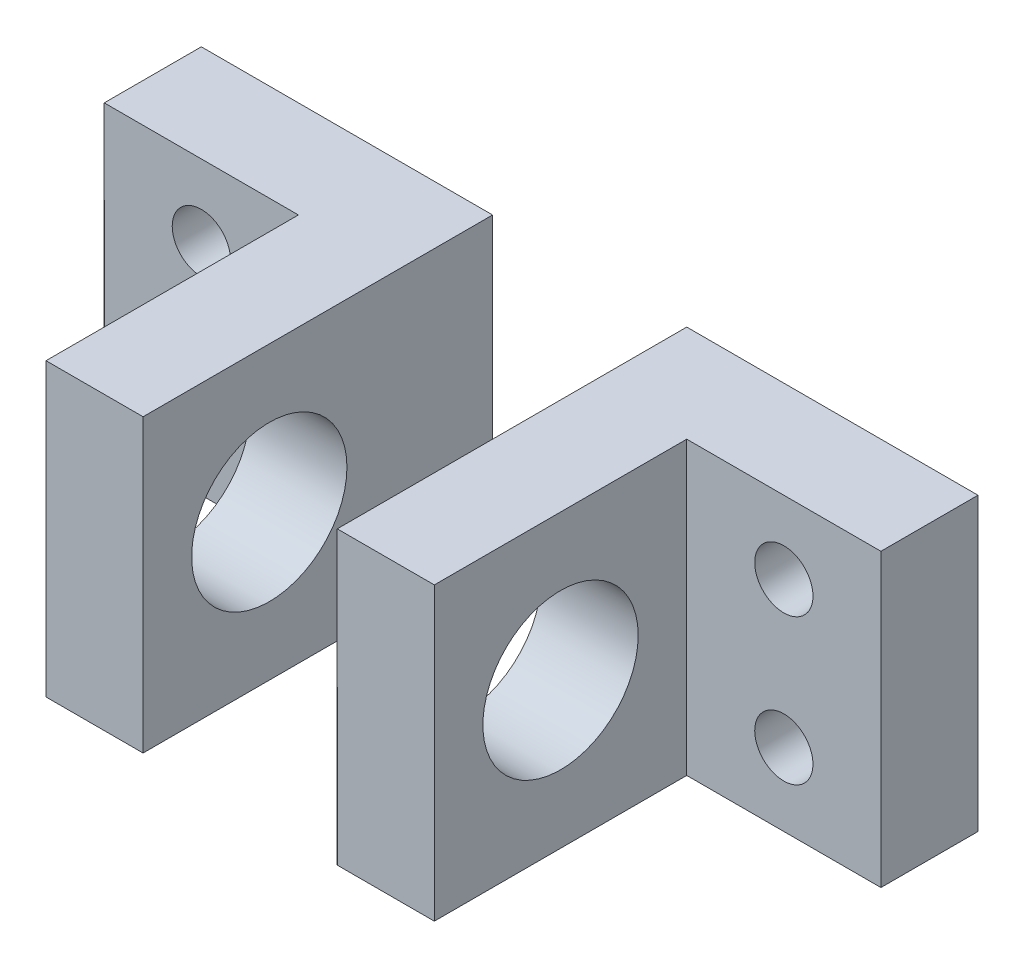
from build123d import *

# Parameters (mm, degrees)
BOSS_EXTRUDE1_DEPTH   = 15
BOSS_EXTRUDE1_2_DEPTH = 15
SKETCH2_R             = 4
CUT_EXTRUDE1_DEPTH    = 39.065732621
SKETCH3_R             = 1.5
CUT_EXTRUDE2_DEPTH    = 29.178005607


with BuildPart() as part:
    # Sketch1 → Boss-Extrude1 (new body)
    with BuildSketch(Plane(origin=(0, 0, 0), x_dir=(1, 0, 0), z_dir=(0, 1, 0))):
        Polygon((-5, 18), (-5, 0), (-10, 0), (-10, 13), (-20, 13), (-20, 18), align=None)
    extrude(amount=BOSS_EXTRUDE1_DEPTH)


with BuildPart() as body_2:
    # Sketch1 → Boss-Extrude1 2 (new body)
    with BuildSketch(Plane(origin=(0, 0, 0), x_dir=(1, 0, 0), z_dir=(0, 1, 0))):
        Polygon((20, 18), (5, 18), (5, 0), (10, 0), (10, 13), (20, 13), align=None)
    extrude(amount=BOSS_EXTRUDE1_2_DEPTH)


with BuildPart() as cut_extrude1_tool:
    # Sketch2 → Cut-Extrude1 (new, through all)
    with BuildSketch(Plane(origin=(10, 0, 0), x_dir=(0, 0, -1), z_dir=(1, 0, 0))):
        with Locations((6.5, 7.5)):
            Circle(SKETCH2_R)
    extrude(amount=-CUT_EXTRUDE1_DEPTH)


with BuildPart() as part_1:
    add(part.part)

    # Cut-Extrude1: cut by cut_extrude1_tool
    add(cut_extrude1_tool.part, mode=Mode.SUBTRACT)


with BuildPart() as body_2_1:
    add(body_2.part)

    # Cut-Extrude1: cut by cut_extrude1_tool
    add(cut_extrude1_tool.part, mode=Mode.SUBTRACT)


with BuildPart() as cut_extrude2_tool:
    # Sketch3 → Cut-Extrude2 (new, through all)
    with BuildSketch(Plane.XY.offset(-13)):
        with Locations((-15, 3.75)):
            Circle(SKETCH3_R)
        with Locations(Location((-15, 11.25, 0), (0, 0, 180))):
            Circle(SKETCH3_R)
        with Locations((15, 11.25)):
            Circle(SKETCH3_R)
        with Locations(Location((15, 3.75, 0), (0, 0, 180))):
            Circle(SKETCH3_R)
    extrude(amount=-CUT_EXTRUDE2_DEPTH)


with BuildPart() as part_2:
    add(part_1.part)

    # Cut-Extrude2: cut by cut_extrude2_tool
    add(cut_extrude2_tool.part, mode=Mode.SUBTRACT)


with BuildPart() as body_2_2:
    add(body_2_1.part)

    # Cut-Extrude2: cut by cut_extrude2_tool
    add(cut_extrude2_tool.part, mode=Mode.SUBTRACT)


solid = Compound([part_2.part, body_2_2.part])
